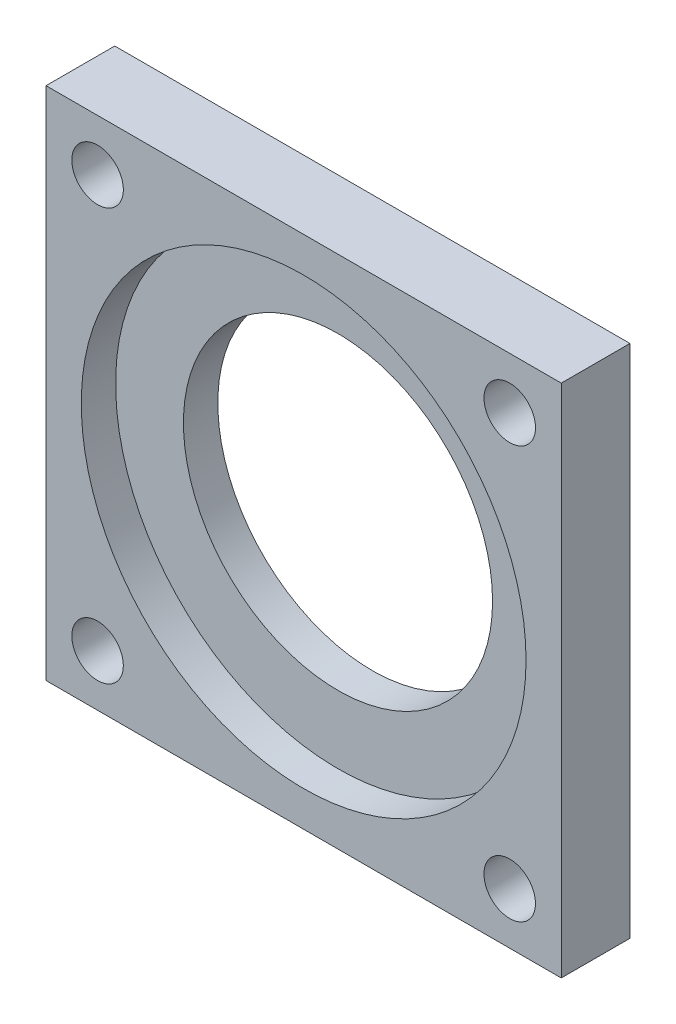
from build123d import *

# Parameters (mm, degrees)
ESBO_O1_W                = 30
ESBO_O1_H                = 30
ESBO_O1_R                = 1.5
RESSALTO_EXTRUS_O1_DEPTH = 4
CORTE_EXTRUS_O1_REACH    = 23.587
ESBO_O2_R                = 9
ESBO_O4_R                = 12.95
CORTE_EXTRUS_O2_DEPTH    = 2


with BuildPart() as part:
    # Esboço1 → Ressalto-extrusão1 (new body)
    with BuildSketch(Plane.XY):
        Rectangle(ESBO_O1_W, ESBO_O1_H)
        with Locations((-12, -12)):
            Circle(ESBO_O1_R, mode=Mode.SUBTRACT)
        with Locations(Location((12, -12, 0), (0, 0, 180))):
            Circle(ESBO_O1_R, mode=Mode.SUBTRACT)
        with Locations((12, 12)):
            Circle(ESBO_O1_R, mode=Mode.SUBTRACT)
        with Locations(Location((-12, 12, 0), (0, 0, 180))):
            Circle(ESBO_O1_R, mode=Mode.SUBTRACT)
    extrude(amount=RESSALTO_EXTRUS_O1_DEPTH)

    # Esboço2 → Corte-extrusão1 (cut, up to next)
    with BuildSketch(Plane.XY.offset(4), mode=Mode.PRIVATE) as corte_extrus_o1_sk1:
        Circle(ESBO_O2_R)
    corte_extrus_o1_tool1 = extrude(corte_extrus_o1_sk1.sketch, amount=-CORTE_EXTRUS_O1_REACH, mode=Mode.PRIVATE) & part.part
    add(corte_extrus_o1_tool1.solids().sort_by_distance((0, 0, 4))[0], mode=Mode.SUBTRACT)

    # Esboço4 → Corte-extrusão2 (cut)
    with BuildSketch(Plane.XY.offset(4)):
        Circle(ESBO_O4_R)
    extrude(amount=-CORTE_EXTRUS_O2_DEPTH, mode=Mode.SUBTRACT)


solid = part.part
